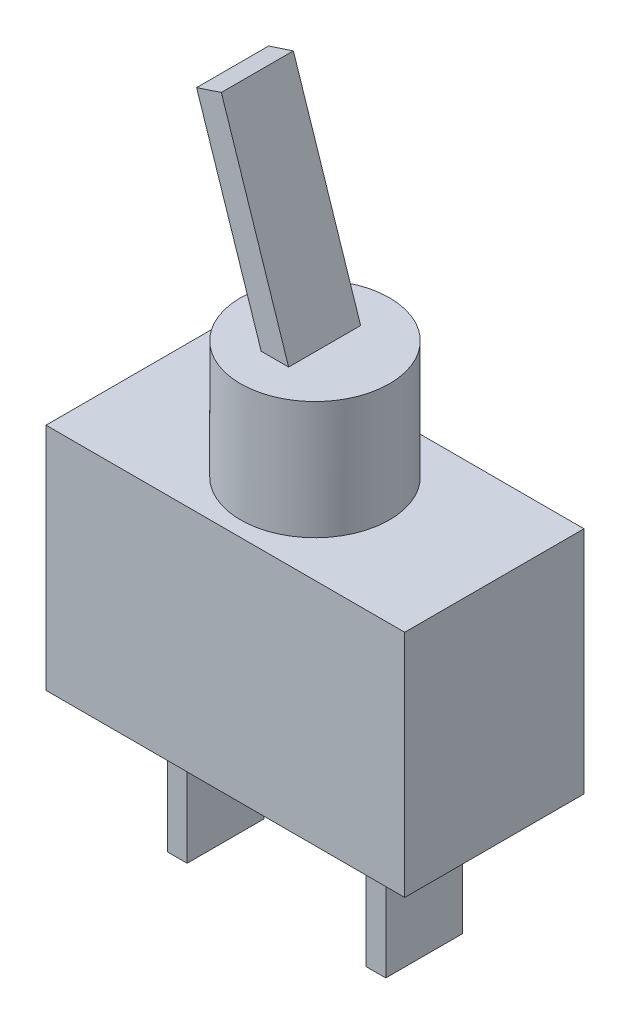
from build123d import *

# Parameters (mm, degrees)
SKETCH1_W           = 28.89
SKETCH1_H           = 18.5
BOSS_EXTRUDE1_DEPTH = 7.22
SKETCH2_R           = 6
BOSS_EXTRUDE2_DEPTH = 18.75
BOSS_EXTRUDE3_DEPTH = 2.9
SKETCH4_W           = 1.6
SKETCH4_H           = 10.5
BOSS_EXTRUDE4_DEPTH = 3.1


with BuildPart() as part:
    # Sketch1 → Boss-Extrude1 (new, symmetric)
    with BuildSketch(Plane.XY):
        Rectangle(SKETCH1_W, SKETCH1_H)
    extrude(amount=BOSS_EXTRUDE1_DEPTH, both=True)

    # Sketch2 → Boss-Extrude2 (add)
    with BuildSketch(Plane(origin=(0, 0, 0), x_dir=(1, 0, 0), z_dir=(0, 1, 0))):
        with Locations(Location((0, 0, 0), (0, 0, 90))):
            Circle(SKETCH2_R)
    extrude(amount=BOSS_EXTRUDE2_DEPTH)

    # Sketch3 → Boss-Extrude3 (add, symmetric)
    with BuildSketch(Plane.XY):
        Polygon((-0.986, 17.391), (0.986, 18.109), (-4.644, 35.199), (-6.636315055, 34.542666837), align=None)
    extrude(amount=BOSS_EXTRUDE3_DEPTH, both=True)

    # Sketch4 → Boss-Extrude4 (add, symmetric)
    with BuildSketch(Plane.XY):
        with Locations((-8, -14.5)):
            Rectangle(SKETCH4_W, SKETCH4_H)
        with Locations((8, -14.5)):
            Rectangle(SKETCH4_W, SKETCH4_H)
    extrude(amount=BOSS_EXTRUDE4_DEPTH, both=True)


solid = part.part
